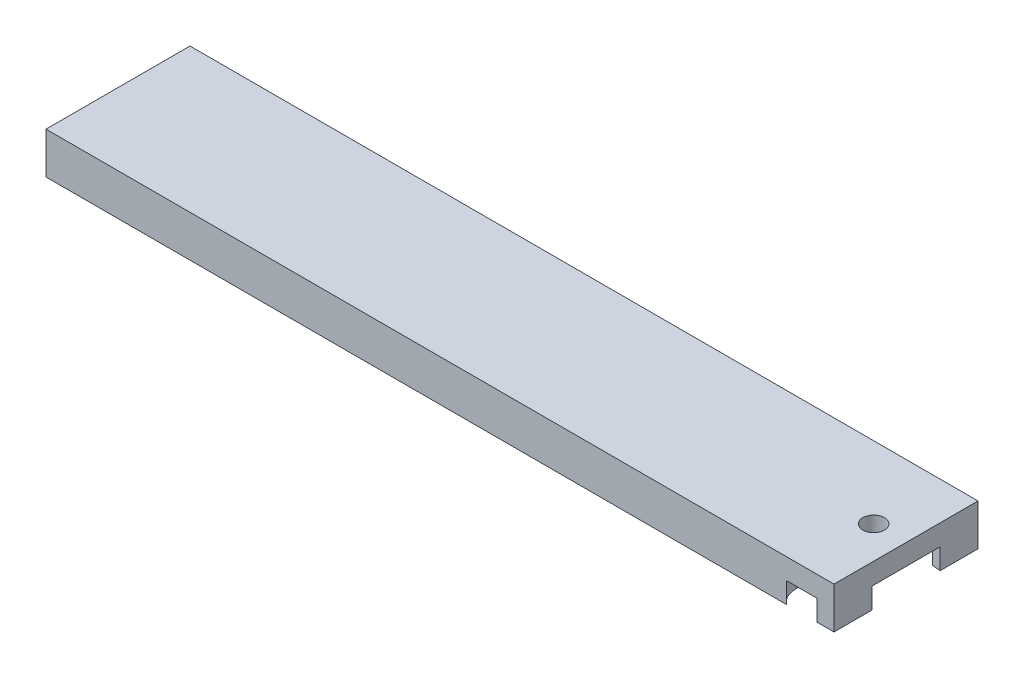
from build123d import *

# Parameters (mm, degrees)
RESSALTO_EXTRUS_O1_DEPTH = 1.4
ESBO_O2_R                = 3.45
RESSALTO_EXTRUS_O2_DEPTH = 2.4
FURO1_D                  = 1.2
PADR_O_LINEAR1_COUNT     = 6
PADR_O_LINEAR1_PITCH     = 2
RESSALTO_EXTRUS_O3_DEPTH = 1.4
FURO2_D                  = 1.2
PADR_O_LINEAR2_COUNT     = 7
PADR_O_LINEAR2_PITCH     = 2
RESSALTO_EXTRUS_O4_DEPTH = 1.4
FURO3_D                  = 1.2
PADR_O_LINEAR3_COUNT     = 2
PADR_O_LINEAR3_PITCH     = 2
PADR_OCIRCULAR1_COUNT    = 2
PADR_OCIRCULAR1_COPY_1_D = 1.2
FURO4_D                  = 4.95
FURO4_DEPTH              = 2
FURO5_D                  = 4.6
FURO5_DEPTH              = 1
FURO6_D                  = 2.1
RESSALTO_EXTRUS_O5_START = -2
RESSALTO_EXTRUS_O5_DEPTH = 2
PADR_OCIRCULAR2_COUNT    = 60
BOSS_EXTRUDE1_DEPTH      = 5
BOSS_EXTRUDE1_2_DEPTH    = 5
BOSS_EXTRUDE1_3_DEPTH    = 5
SKETCH2_W                = 100
SKETCH2_H                = 17.359649926
BOSS_EXTRUDE2_DEPTH      = 2.5
SKETCH3_R                = 1.3
CUT_EXTRUDE1_DEPTH       = 92.764859077
SKETCH4_W                = 52.17150673
SKETCH4_H                = 37.712890546
CUT_EXTRUDE2_DEPTH       = 92.649055431
CUT_EXTRUDE3_DEPTH       = 2.5
SKETCH6_W                = 5
SKETCH6_H                = 17.359649926
CUT_EXTRUDE5_DEPTH       = 10


with BuildPart() as part:
    # Esboço1 → Ressalto-extrusão1 (new body)
    with BuildSketch(Plane(origin=(0, 0, 0), x_dir=(1, 0, 0), z_dir=(0, 1, 0))):
        with BuildLine():
            Line((-14.159121967, 1.99702088), (-2.209072203, 2.65))
            ThreePointArc((-2.209072203, 2.65), (3.45, 0), (-2.209072203, -2.65))
            Line((-2.209072203, -2.65), (-14.159121967, -1.99702088))
            ThreePointArc((-14.159121967, -1.99702088), (-16.05, 0), (-14.159121967, 1.99702088))
        make_face()
    extrude(amount=-RESSALTO_EXTRUS_O1_DEPTH)

    # Esboço2 → Ressalto-extrusão2 (add)
    with BuildSketch(Plane.XZ.offset(1.4)):
        with Locations(Location((0, 0, 0), (0, 0, 90))):
            Circle(ESBO_O2_R)
    extrude(amount=RESSALTO_EXTRUS_O2_DEPTH)

    # Furo1 (through all)
    with Locations(Plane(origin=(0, 0, 0), x_dir=(1, 0, 0), z_dir=(0, 1, 0))):
        with Locations((-14.45, 0)):
            furo1 = Hole(FURO1_D / 2)

    # Padrão linear1: Furo1 ×6
    with Locations(*[(i * PADR_O_LINEAR1_PITCH, 0, 0) for i in range(1, PADR_O_LINEAR1_COUNT)]):
        add(furo1, mode=Mode.SUBTRACT)

    # Esboço12 → Ressalto-extrusão3 (add)
    with BuildSketch(Plane(origin=(0, 0, 0), x_dir=(1, 0, 0), z_dir=(0, 1, 0))):
        with BuildLine():
            Line((0.304103343, 3.436571134), (16.626291793, 1.99221515))
            ThreePointArc((16.626291793, 1.99221515), (18.45, 0), (16.626291793, -1.99221515))
            Line((16.626291793, -1.99221515), (0.304103343, -3.436571134))
            ThreePointArc((0.304103343, -3.436571134), (3.45, 0), (0.304103343, 3.436571134))
        make_face()
    extrude(amount=-RESSALTO_EXTRUS_O3_DEPTH)

    # Furo2 (through all)
    with Locations(Plane(origin=(0, 0, 0), x_dir=(1, 0, 0), z_dir=(0, 1, 0))):
        with Locations((16.85, 0)):
            furo2 = Hole(FURO2_D / 2)

    # Padrão linear2: Furo2 ×7
    with Locations(*[(-i * PADR_O_LINEAR2_PITCH, 0, 0) for i in range(1, PADR_O_LINEAR2_COUNT)]):
        add(furo2, mode=Mode.SUBTRACT)

    # Esboço16 → Ressalto-extrusão4 (add)
    with BuildSketch(Plane(origin=(0, 0, 0), x_dir=(1, 0, 0), z_dir=(0, 1, 0))):
        with BuildLine():
            Line((-1.9, -6.45), (-1.9, 6.45))
            ThreePointArc((-1.9, 6.45), (0, 8.35), (1.9, 6.45))
            Line((1.9, 6.45), (1.9, -6.45))
            ThreePointArc((1.9, -6.45), (0, -8.35), (-1.9, -6.45))
        make_face()
    extrude(amount=-RESSALTO_EXTRUS_O4_DEPTH)

    # Furo3 (through all)
    with Locations(Plane(origin=(0, 0, 0), x_dir=(1, 0, 0), z_dir=(0, 1, 0))):
        with Locations((0, -6.45)):
            furo3 = Hole(FURO3_D / 2)

    # Padrão linear3: Furo3 ×2
    with Locations(*[(0, 0, -i * PADR_O_LINEAR3_PITCH) for i in range(1, PADR_O_LINEAR3_COUNT)]):
        add(furo3, mode=Mode.SUBTRACT)

    # PadrãoCircular1: Furo3 ×2 about axis
    padr_ocircular1_axis = Axis((0, 0, 0), (0, 1, 0))
    for i in range(1, PADR_OCIRCULAR1_COUNT):
        add(furo3.rotate(padr_ocircular1_axis, i * 360 / PADR_OCIRCULAR1_COUNT), mode=Mode.SUBTRACT)

    # PadrãoCircular1 copy 1 (through all)
    with Locations(Plane(origin=(0, 0, 2), x_dir=(-1, 0, 0), z_dir=(0, 1, 0))):
        with Locations((0, -6.45)):
            Hole(PADR_OCIRCULAR1_COPY_1_D / 2)

    # Furo4
    with Locations(Plane(origin=(0, -3.8, 0), x_dir=(-1, 0, 0), z_dir=(0, -1, 0))):
        with Locations((0, 0)):
            Hole(FURO4_D / 2, depth=FURO4_DEPTH)

    # Furo5
    with Locations(Plane(origin=(0, 0, 0), x_dir=(1, 0, 0), z_dir=(0, 1, 0))):
        with Locations((0, 0)):
            Hole(FURO5_D / 2, depth=FURO5_DEPTH)

    # Furo6 (through all)
    with Locations(Plane(origin=(0, 0, 0), x_dir=(1, 0, 0), z_dir=(0, 1, 0))):
        with Locations((0, 0)):
            Hole(FURO6_D / 2)

    # Esboço11 → Ressalto-extrusão5 (add)
    with BuildSketch(Plane.XZ.offset(3.8).offset(RESSALTO_EXTRUS_O5_START)):
        with BuildLine():
            Line((-0.098056786, 2.473056786), (0, 2.375))
            Line((0, 2.375), (0.098056786, 2.473056786))
            ThreePointArc((0.098056786, 2.473056786), (0, 2.475), (-0.098056786, 2.473056786))
        make_face()
    ressalto_extrus_o5 = extrude(amount=RESSALTO_EXTRUS_O5_DEPTH)

    # PadrãoCircular2: Ressalto-extrusão5 ×60 about axis
    padr_ocircular2_axis = Axis((0, 0, 0), (0, 1, 0))
    for i in range(1, PADR_OCIRCULAR2_COUNT):
        add(ressalto_extrus_o5.rotate(padr_ocircular2_axis, i * 360 / PADR_OCIRCULAR2_COUNT))


with BuildPart() as body_2:
    # Sketch1 → Boss-Extrude1 (new body)
    with BuildSketch(Plane(origin=(0, 0, 0), x_dir=(1, 0, 0), z_dir=(0, 1, 0))):
        with BuildLine():
            ThreePointArc((-2.9, 6.45), (-2.625551521, 7.681454104), (-1.854152269, 8.679824963))
            Line((-1.854152269, 8.679824963), (-91.1, 8.679824963))
            Line((-91.1, 8.679824963), (-91.1, -8.679824963))
            Line((-91.1, -8.679824963), (-1.854152269, -8.679824963))
            ThreePointArc((-1.854152269, -8.679824963), (-2.625551521, -7.681454104), (-2.9, -6.45))
            Line((-2.9, -6.45), (-2.9, -3.613737845))
            Line((-2.9, -3.613737845), (-14.213682951, -2.99553132))
            ThreePointArc((-14.213682951, -2.99553132), (-17.05, 0), (-14.213682951, 2.99553132))
            Line((-14.213682951, 2.99553132), (-2.9, 3.613737845))
            Line((-2.9, 3.613737845), (-2.9, 6.45))
        make_face()
    extrude(amount=BOSS_EXTRUDE1_DEPTH)



with BuildPart() as body_3:
    # Sketch1 → Boss-Extrude1 2 (new body)
    with BuildSketch(Plane(origin=(0, 0, 0), x_dir=(1, 0, 0), z_dir=(0, 1, 0))):
        with BuildLine():
            Line((2.9, 4.210766995), (8.9, 3.679824963))
            Line((8.9, 3.679824963), (8.9, 8.679824963))
            Line((8.9, 8.679824963), (1.854152269, 8.679824963))
            ThreePointArc((1.854152269, 8.679824963), (2.625551521, 7.681454104), (2.9, 6.45))
            Line((2.9, 6.45), (2.9, 4.210766995))
        make_face()
    extrude(amount=BOSS_EXTRUDE1_2_DEPTH)


with BuildPart() as body_4:
    # Sketch1 → Boss-Extrude1 3 (new body)
    with BuildSketch(Plane(origin=(0, 0, 0), x_dir=(1, 0, 0), z_dir=(0, 1, 0))):
        with BuildLine():
            Line((8.9, -8.679824963), (8.9, -3.679824963))
            Line((8.9, -3.679824963), (2.9, -4.210766995))
            Line((2.9, -4.210766995), (2.9, -6.45))
            ThreePointArc((2.9, -6.45), (2.625551521, -7.681454104), (1.854152269, -8.679824963))
            Line((1.854152269, -8.679824963), (8.9, -8.679824963))
        make_face()
    extrude(amount=BOSS_EXTRUDE1_3_DEPTH)


with BuildPart() as body_2_1:
    add(body_2.part)

    add(body_3.part)  # Boss-Extrude2 merges body 3

    add(body_4.part)  # Boss-Extrude2 merges body 4
    # Sketch2 → Boss-Extrude2 (add)
    with BuildSketch(Plane(origin=(0, 5, 0), x_dir=(1, 0, 0), z_dir=(0, 1, 0))):
        with Locations((-41.1, 0)):
            Rectangle(SKETCH2_W, SKETCH2_H)
    extrude(amount=-BOSS_EXTRUDE2_DEPTH)


with BuildPart() as cut_extrude1_tool:
    # Sketch3 → Cut-Extrude1 (new, through all)
    with BuildSketch(Plane.XZ.offset(1.8)):
        with Locations(Location((0, 0, 0), (0, 0, 270))):
            Circle(SKETCH3_R)
    extrude(amount=-CUT_EXTRUDE1_DEPTH)


with BuildPart() as part_1:
    add(part.part)

    # Cut-Extrude1: cut by cut_extrude1_tool
    add(cut_extrude1_tool.part, mode=Mode.SUBTRACT)

    # Sketch4 → Cut-Extrude2 (cut, through all)
    with BuildSketch(Plane.XZ):
        with Locations((5.123033061, -1.807327023)):
            Rectangle(SKETCH4_W, SKETCH4_H)
    extrude(amount=CUT_EXTRUDE2_DEPTH, mode=Mode.SUBTRACT)


with BuildPart() as body_2_2:
    add(body_2_1.part)

    # Cut-Extrude1: cut by cut_extrude1_tool
    add(cut_extrude1_tool.part, mode=Mode.SUBTRACT)

    # Sketch5 → Cut-Extrude3 (cut)
    with BuildSketch(Plane.XZ):
        with BuildLine():
            Line((-14.213682951, 2.99553132), (-21.713682951, 2.585713496))
            ThreePointArc((-21.713682951, 2.585713496), (-24.299396446, 0), (-21.713682951, -2.585713496))
            Line((-21.713682951, -2.585713496), (-14.213682951, -2.99553132))
            Line((-14.213682951, -2.99553132), (-14.213682951, 2.99553132))
        make_face()
    extrude(amount=-CUT_EXTRUDE3_DEPTH, mode=Mode.SUBTRACT)

    # Sketch6 → Cut-Extrude5 (cut)
    with BuildSketch(Plane.XZ):
        with Locations((6.4, 0)):
            Rectangle(SKETCH6_W, SKETCH6_H)
    extrude(amount=-CUT_EXTRUDE5_DEPTH, mode=Mode.SUBTRACT)


solid = body_2_2.part
